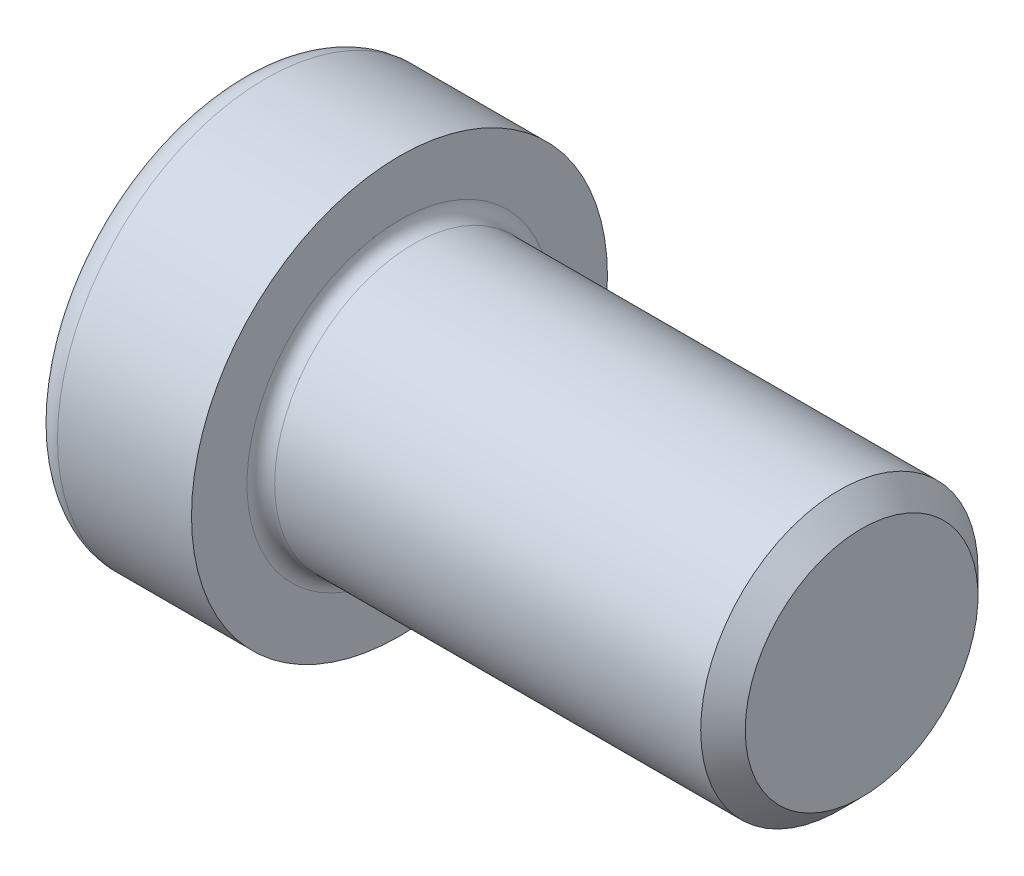
from build123d import *

# Parameters (mm, degrees)
FILLET1_R   = 0.6
FILLET2_R   = 1.2
HEX_2_DEPTH = 5


with BuildPart() as part:
    # BodySke → Base-Revolve (revolve)
    with BuildSketch(Plane.XY, mode=Mode.PRIVATE) as base_revolve_sk:
        Polygon((0, 0), (0, 9), (7, 9), (7, 6), (26.036, 6), (27, 5.036), (27, 0), align=None)
    revolve(base_revolve_sk.sketch.rotate(Axis((-31.75, 0, 0), (1, 0, 0)), 90), axis=Axis((-31.75, 0, 0), (1, 0, 0)))

    # Fillet1
    fillet1_edges = [part.edges().sort_by_distance(p)[0] for p in [
        (7, 0, -6),
    ]]
    fillet(fillet1_edges, radius=FILLET1_R)

    # Fillet2
    fillet2_edges = [part.edges().sort_by_distance(p)[0] for p in [
        (0, 0, -9),
    ]]
    fillet(fillet2_edges, radius=FILLET2_R)

    # Sketch2 → Hex-PreBroach (revolve, cut)
    with BuildSketch(Plane.XY, mode=Mode.PRIVATE) as hex_prebroach_sk:
        Polygon((0, 4), (5, 4), (7.309401077, 0), (0, 0), align=None)
    revolve(hex_prebroach_sk.sketch.rotate(Axis((0, 0, 0), (1, 0, 0)), 90), axis=Axis((0, 0, 0), (1, 0, 0)), mode=Mode.SUBTRACT)

    # Sketch3 → Hex 2 (cut)
    with BuildSketch(Plane(origin=(0, 0, 0), x_dir=(0, 0.500000000000001, 0.866025403784438), z_dir=(-1, 0, 0))):
        Polygon((2.309401077, 4), (-2.309401077, 4), (-4.618802154, 0), (-2.309401077, -4), (2.309401077, -4), (4.618802154, 0), align=None)
    extrude(amount=-HEX_2_DEPTH, mode=Mode.SUBTRACT)


solid = part.part
